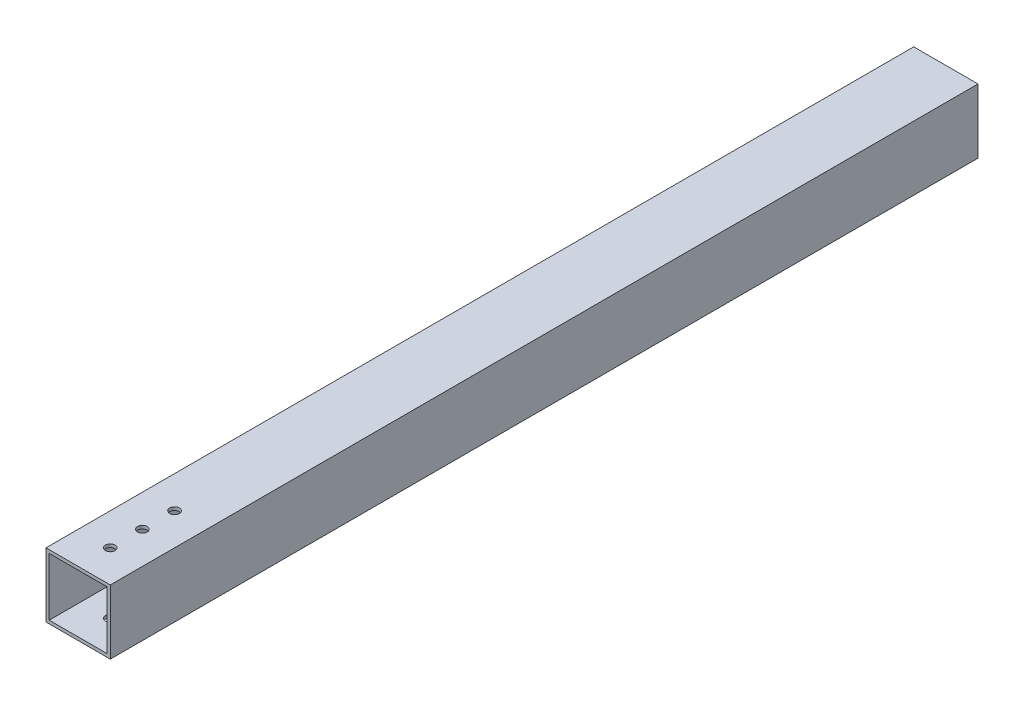
from build123d import *

# Parameters (mm, degrees)
SKETCH_1_W          = 20
SKETCH_1_H          = 20
SKETCH_1_W_2        = 18
SKETCH_1_H_2        = 18
EXTRUDE_1_DEPTH     = 135
SKETCH_2_R          = 1.5
CUT_EXTRUDE_1_DEPTH = 100


with BuildPart() as part:
    # 草图1 → 凸台-拉伸1 (new, symmetric)
    with BuildSketch(Plane.XY):
        Rectangle(SKETCH_1_W, SKETCH_1_H)
        Rectangle(SKETCH_1_W_2, SKETCH_1_H_2, mode=Mode.SUBTRACT)
    extrude(amount=EXTRUDE_1_DEPTH, both=True)

    # 草图2 → 切除-拉伸1 (cut)
    with BuildSketch(Plane(origin=(0, 10, 0), x_dir=(1, 0, 0), z_dir=(0, 1, 0))):
        with Locations(Location((0, -125, 0), (0, 0, 270))):
            Circle(SKETCH_2_R)
        with Locations(Location((0, -115, 0), (0, 0, 270))):
            Circle(SKETCH_2_R)
        with Locations(Location((0, -105, 0), (0, 0, 270))):
            Circle(SKETCH_2_R)
    extrude(amount=-CUT_EXTRUDE_1_DEPTH, mode=Mode.SUBTRACT)


solid = part.part
